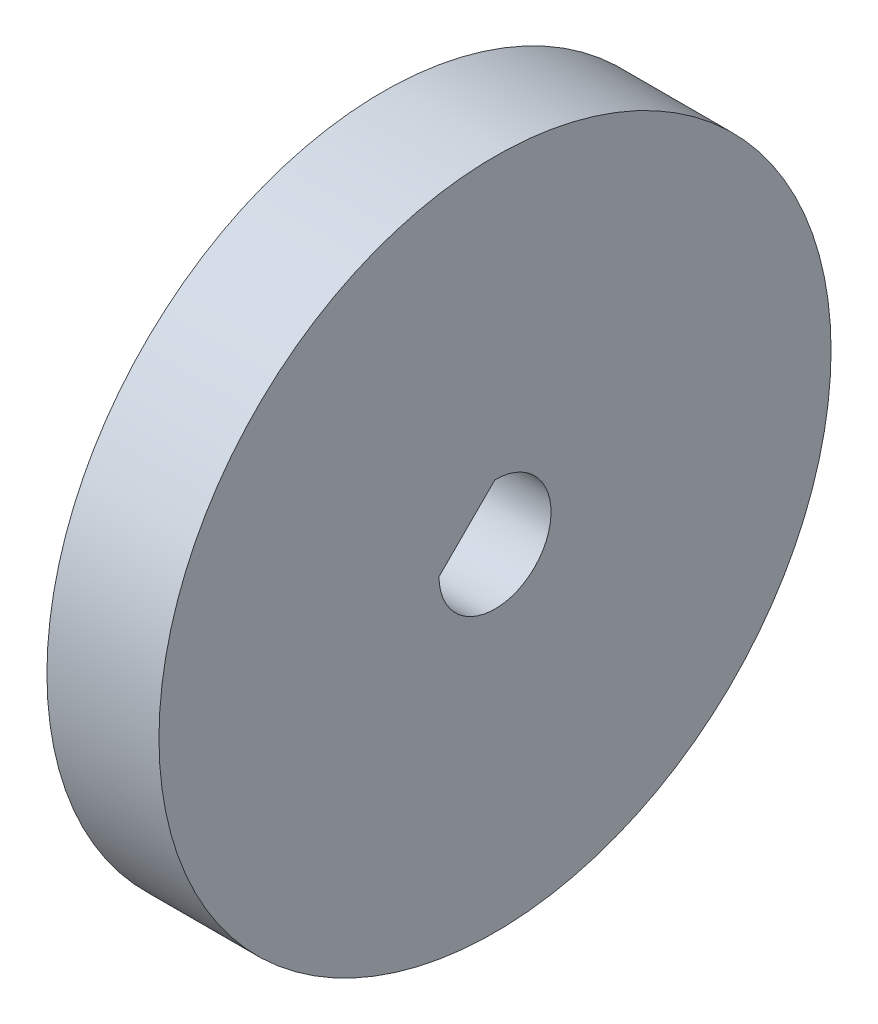
from build123d import *

# Parameters (mm, degrees)
SKETCH1_R           = 19.05
BOSS_EXTRUDE1_DEPTH = 6.35
CUT_EXTRUDE1_REACH  = 29.679


with BuildPart() as part:
    # Sketch1 → Boss-Extrude1 (new body)
    with BuildSketch(Plane(origin=(0, 0, 0), x_dir=(0, 0, -1), z_dir=(1, 0, 0))):
        Circle(SKETCH1_R)
    extrude(amount=BOSS_EXTRUDE1_DEPTH)

    # Sketch2 → Cut-Extrude1 (cut, up to next)
    with BuildSketch(Plane.ZY, mode=Mode.PRIVATE) as cut_extrude1_sk1:
        with BuildLine():
            Line((0, 3.175), (3.175, 0))
            ThreePointArc((3.175, 0), (-2.24506403, -2.24506403), (0, 3.175))
        make_face()
    cut_extrude1_tool1 = extrude(cut_extrude1_sk1.sketch, amount=-CUT_EXTRUDE1_REACH, mode=Mode.PRIVATE) & part.part
    add(cut_extrude1_tool1.solids().sort_by_distance((0, -0.18527, -0.18527))[0], mode=Mode.SUBTRACT)


solid = part.part
